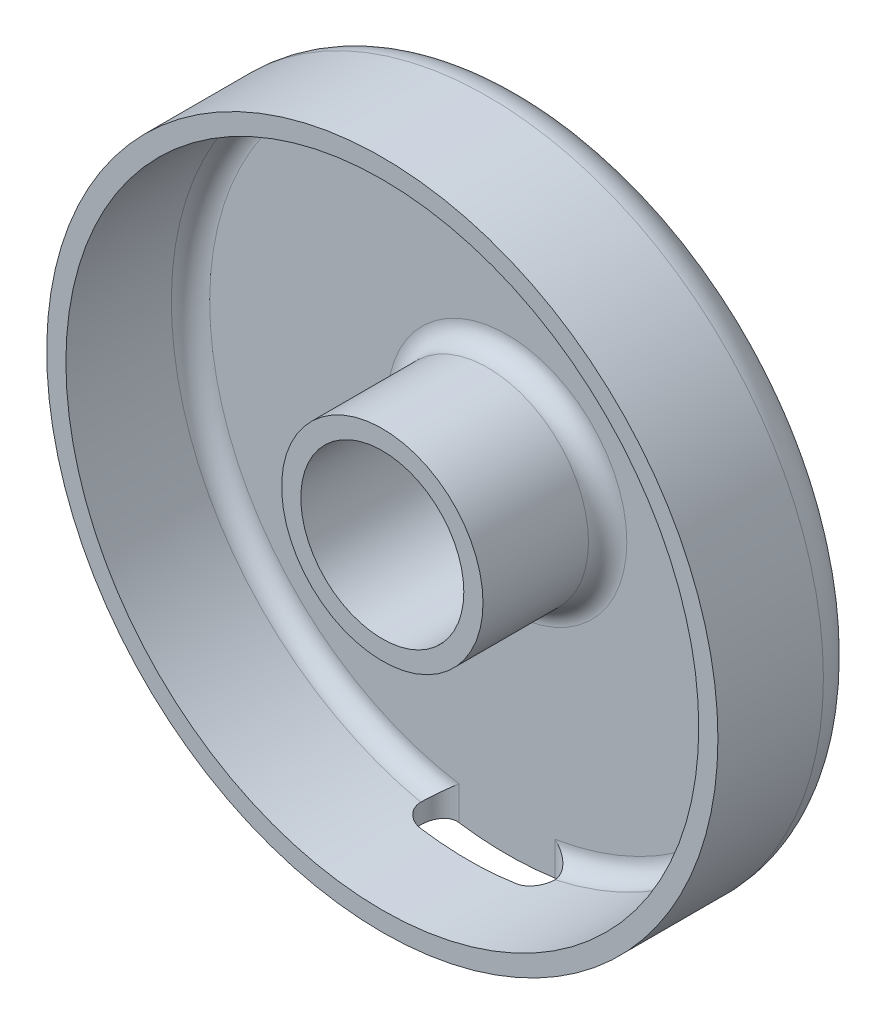
from build123d import *

# Parameters (mm, degrees)
CROQUIS1_R              = 35
SALIENTE_EXTRUIR1_DEPTH = 15
CROQUIS2_R              = 8.5
CORTAR_EXTRUIR1_DEPTH   = 52.720402164
VACIADO1_T              = -2
REDONDEO1_R             = 2
REDONDEO2_R             = 4
CORTAR_EXTRUIR2_START   = -25
CORTAR_EXTRUIR2_DEPTH   = 27.720402164


with BuildPart() as part:
    # Croquis1 → Saliente-Extruir1 (new body)
    with BuildSketch(Plane.XY):
        Circle(CROQUIS1_R)
    extrude(amount=SALIENTE_EXTRUIR1_DEPTH)

    # Croquis2 → Cortar-Extruir1 (cut, through all)
    with BuildSketch(Plane.XY.offset(15)):
        Circle(CROQUIS2_R)
    extrude(amount=-CORTAR_EXTRUIR1_DEPTH, mode=Mode.SUBTRACT)

    # Vaciado1
    vaciado1_openings = [part.faces().sort_by_distance(p)[0] for p in [
        (-34.010050506, 0, 15),
    ]]
    offset(amount=VACIADO1_T, openings=vaciado1_openings, kind=Kind.INTERSECTION)

    # Redondeo1
    redondeo1_edges = [part.edges().sort_by_distance(p)[0] for p in [
        (-33, 0, 2),
        (-10.5, 0, 2),
    ]]
    fillet(redondeo1_edges, radius=REDONDEO1_R)

    # Redondeo2
    redondeo2_edges = [part.edges().sort_by_distance(p)[0] for p in [
        (-35, 0, 0),
    ]]
    fillet(redondeo2_edges, radius=REDONDEO2_R)

    # Croquis3 → Cortar-Extruir2 (cut, through all)
    with BuildSketch(Plane(origin=(0, 0, 0), x_dir=(1, 0, 0), z_dir=(0, 1, 0)).offset(CORTAR_EXTRUIR2_START)):
        with BuildLine():
            Line((-5, -2), (5, -2))
            ThreePointArc((5, -2), (7, -4), (5, -6))
            Line((5, -6), (-5, -6))
            ThreePointArc((-5, -6), (-7, -4), (-5, -2))
        make_face()
    extrude(amount=-CORTAR_EXTRUIR2_DEPTH, mode=Mode.SUBTRACT)


solid = part.part
